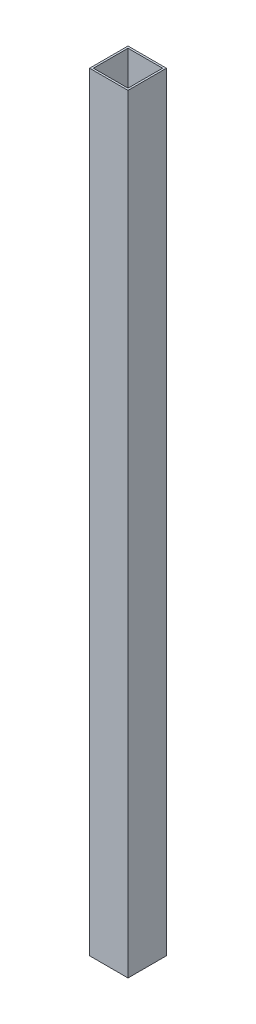
from build123d import *

# Parameters (mm, degrees)
ESQUISSE1_W        = 20
ESQUISSE1_H        = 20
ESQUISSE1_W_2      = 18
ESQUISSE1_H_2      = 18
BOSS_EXTRU_1_DEPTH = 400


with BuildPart() as part:
    # Esquisse1 → Boss.-Extru.1 (new body)
    with BuildSketch(Plane(origin=(0, 0, 0), x_dir=(1, 0, 0), z_dir=(0, 1, 0))):
        Rectangle(ESQUISSE1_W, ESQUISSE1_H)
        Rectangle(ESQUISSE1_W_2, ESQUISSE1_H_2, mode=Mode.SUBTRACT)
    extrude(amount=BOSS_EXTRU_1_DEPTH)


solid = part.part
